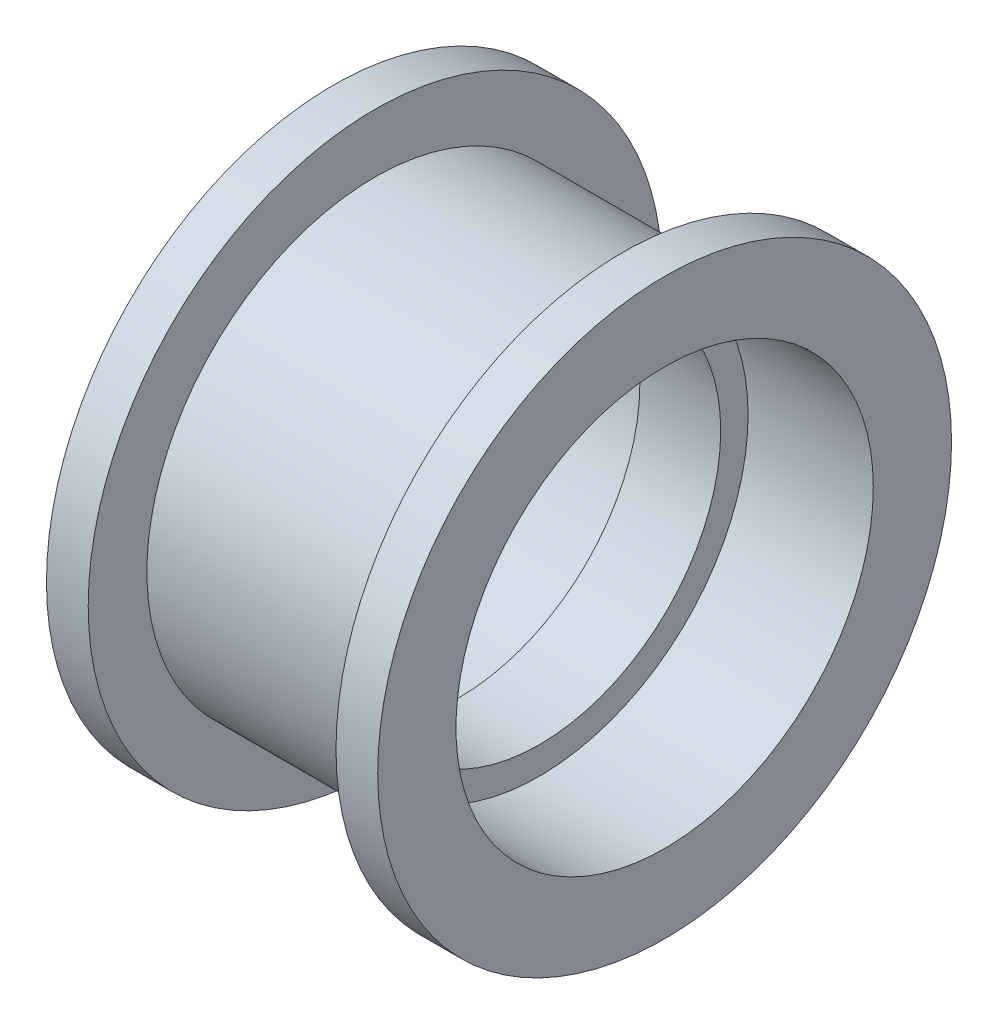
from build123d import *


with BuildPart() as part:
    # Sketch1 → Revolve1 (revolve)
    with BuildSketch(Plane.XY, mode=Mode.PRIVATE) as revolve1_sk:
        Polygon((1.55, 6.95), (-1.55, 6.95), (-1.55, 8), (-6.35, 8), (-6.35, 11), (-4.75, 11), (-4.75, 8.75), (4.75, 8.75), (4.75, 11), (6.35, 11), (6.35, 8), (1.55, 8), align=None)
    revolve(revolve1_sk.sketch.rotate(Axis((0, 0, 0), (-1, 0, 0)), 90), axis=Axis((0, 0, 0), (-1, 0, 0)))


solid = part.part
